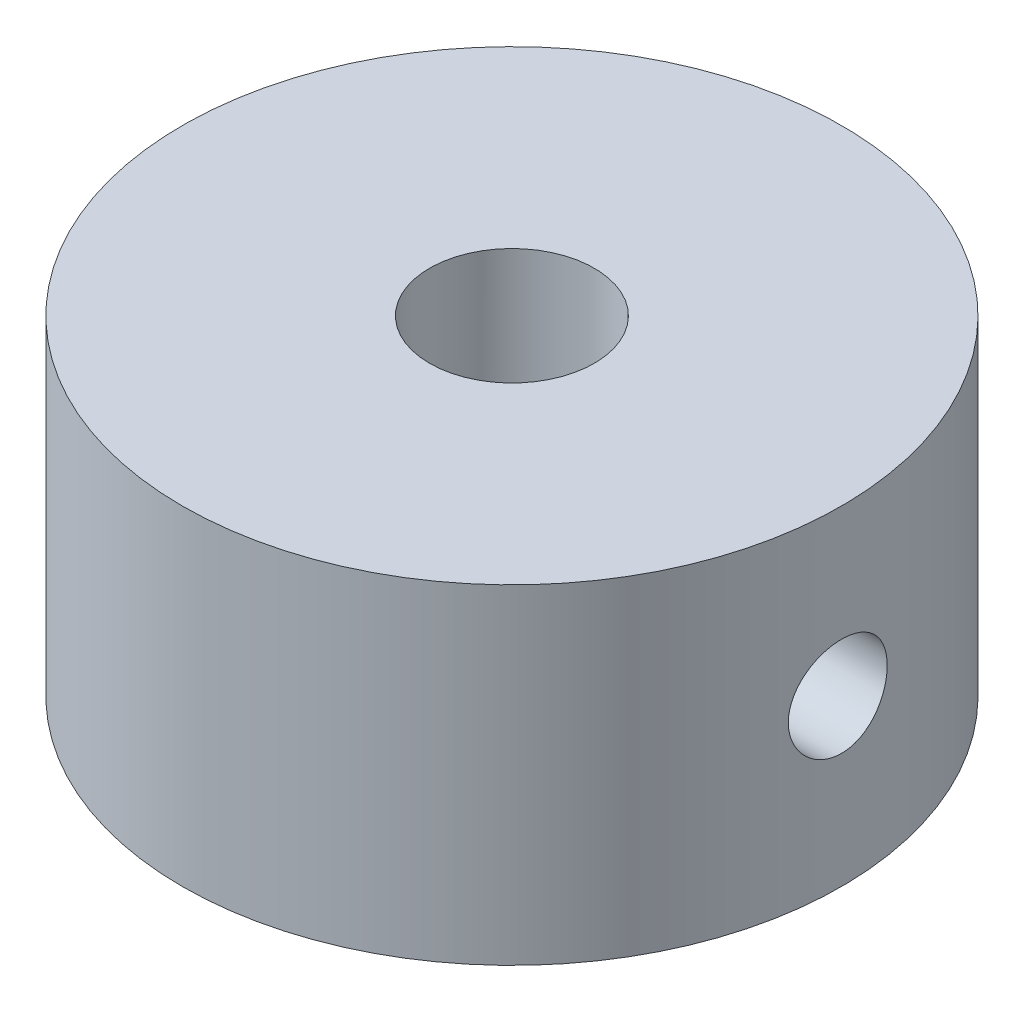
from build123d import *

# Parameters (mm, degrees)
SKETCH1_R               = 10
SKETCH1_R_2             = 2.5
BOSS_EXTRUDE1_DEPTH     = 10
CUT_EXTRUDE1_DEPTH      = 19
CUT_EXTRUDE1_DEPTH_BACK = 18
SKETCH2_R               = 1.5


with BuildPart() as part:
    # Sketch1 → Boss-Extrude1 (new body)
    with BuildSketch(Plane(origin=(0, 0, 0), x_dir=(1, 0, 0), z_dir=(0, 1, 0))):
        with Locations(Location((0, 0, 0), (0, 0, 270))):
            Circle(SKETCH1_R)
        with Locations(Location((0, 0, 0), (0, 0, 270))):
            Circle(SKETCH1_R_2, mode=Mode.SUBTRACT)
    extrude(amount=BOSS_EXTRUDE1_DEPTH)

    # Sketch2 → Cut-Extrude1 (cut, two sides: drawn at the far end of the back side and taken through both)
    with BuildSketch(Plane(origin=(0, 0, 0), x_dir=(0, 0, -1), z_dir=(1, 0, 0)).offset(-CUT_EXTRUDE1_DEPTH_BACK)):
        with Locations((0, 5)):
            Circle(SKETCH2_R)
    extrude(amount=CUT_EXTRUDE1_DEPTH + CUT_EXTRUDE1_DEPTH_BACK, mode=Mode.SUBTRACT)


solid = part.part
